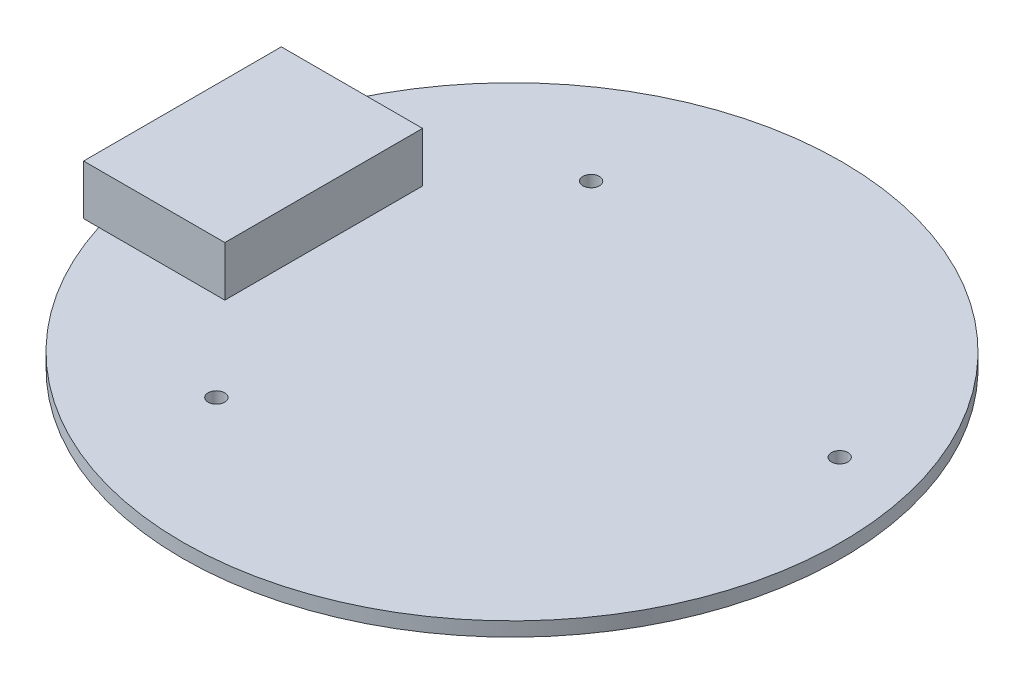
from build123d import *

# Parameters (mm, degrees)
SKETCH1_R                      = 35
BOSS_EXTRUDE1_DEPTH            = 1.5
SKETCH4_W                      = 15
SKETCH4_H                      = 21
BOSS_EXTRUDE2_DEPTH            = 5.3
TAP_DRILL_FOR_M2_2X0_45_TAP1_D = 1.75


with BuildPart() as part:
    # Sketch1 → Boss-Extrude1 (new body)
    with BuildSketch(Plane(origin=(0, 0, 0), x_dir=(1, 0, 0), z_dir=(0, 1, 0))):
        with Locations(Location((0, 0, 0), (0, 0, 270))):
            Circle(SKETCH1_R)
    extrude(amount=BOSS_EXTRUDE1_DEPTH)

    # Sketch4 → Boss-Extrude2 (add)
    with BuildSketch(Plane(origin=(0, 1.5, 0), x_dir=(1, 0, 0), z_dir=(0, 1, 0))):
        with Locations((-27.5, 0)):
            Rectangle(SKETCH4_W, SKETCH4_H)
    extrude(amount=BOSS_EXTRUDE2_DEPTH)

    # Tap Drill for M2.2x0.45 Tap1 (through all)
    with Locations(Plane(origin=(-11.5, 1.5, -19.9), x_dir=(0, 0, 1), z_dir=(0, 1, 0))):
        with Locations((0, 0), (12.2, 38.6), (39.8, 0)):
            Hole(TAP_DRILL_FOR_M2_2X0_45_TAP1_D / 2)


solid = part.part
